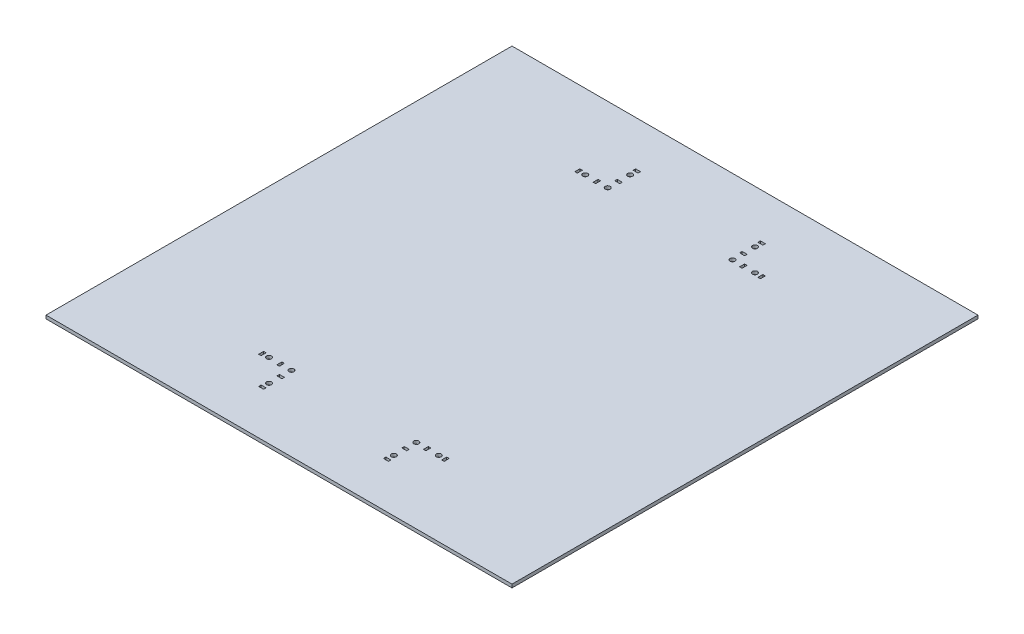
from build123d import *

# Parameters (mm, degrees)
SKETCH_1_W          = 560
SKETCH_1_H          = 560
EXTRUDE_1_DEPTH     = 4
SKETCH_2_R          = 3
SKETCH_2_W          = 3
SKETCH_2_H          = 6
SKETCH_2_W_2        = 6
SKETCH_2_H_2        = 3
CUT_EXTRUDE_1_DEPTH = 4


with BuildPart() as part:
    # 草图1 → 凸台-拉伸1 (new body)
    with BuildSketch(Plane(origin=(0, 0, 0), x_dir=(1, 0, 0), z_dir=(0, 1, 0))):
        Rectangle(SKETCH_1_W, SKETCH_1_H)
    extrude(amount=EXTRUDE_1_DEPTH)

    # 草图2 → 切除-拉伸1 (cut)
    with BuildSketch(Plane(origin=(0, 4, 0), x_dir=(1, 0, 0), z_dir=(0, 1, 0))):
        with Locations(Location((-75, 190, 0), (0, 0, 270))):
            Circle(SKETCH_2_R)
        with Locations(Location((-102, 190, 0), (0, 0, 270))):
            Circle(SKETCH_2_R)
        with Locations(Location((-75, 217, 0), (0, 0, 90))):
            Circle(SKETCH_2_R)
        with Locations(Location((75, 217, 0), (0, 0, 270))):
            Circle(SKETCH_2_R)
        with Locations(Location((102, 190, 0), (0, 0, 90))):
            Circle(SKETCH_2_R)
        with Locations(Location((75, 190, 0), (0, 0, 90))):
            Circle(SKETCH_2_R)
        with Locations(Location((75, -190, 0), (0, 0, 270))):
            Circle(SKETCH_2_R)
        with Locations(Location((102, -190, 0), (0, 0, 270))):
            Circle(SKETCH_2_R)
        with Locations(Location((75, -217, 0), (0, 0, 90))):
            Circle(SKETCH_2_R)
        with Locations(Location((-75, -217, 0), (0, 0, 270))):
            Circle(SKETCH_2_R)
        with Locations(Location((-102, -190, 0), (0, 0, 90))):
            Circle(SKETCH_2_R)
        with Locations(Location((-75, -190, 0), (0, 0, 90))):
            Circle(SKETCH_2_R)
        with Locations((-88, 190)):
            Rectangle(SKETCH_2_W, SKETCH_2_H)
        with Locations((-110, 190)):
            Rectangle(SKETCH_2_W, SKETCH_2_H)
        with Locations((-75, 225)):
            Rectangle(SKETCH_2_W_2, SKETCH_2_H_2)
        with Locations((-75, 203)):
            Rectangle(SKETCH_2_W_2, SKETCH_2_H_2)
        with Locations((75, 203)):
            Rectangle(SKETCH_2_W_2, SKETCH_2_H_2)
        with Locations((75, 225)):
            Rectangle(SKETCH_2_W_2, SKETCH_2_H_2)
        with Locations((110, 190)):
            Rectangle(SKETCH_2_W, SKETCH_2_H)
        with Locations((88, 190)):
            Rectangle(SKETCH_2_W, SKETCH_2_H)
        with Locations((88, -190)):
            Rectangle(SKETCH_2_W, SKETCH_2_H)
        with Locations((110, -190)):
            Rectangle(SKETCH_2_W, SKETCH_2_H)
        with Locations((75, -225)):
            Rectangle(SKETCH_2_W_2, SKETCH_2_H_2)
        with Locations((75, -203)):
            Rectangle(SKETCH_2_W_2, SKETCH_2_H_2)
        with Locations((-75, -203)):
            Rectangle(SKETCH_2_W_2, SKETCH_2_H_2)
        with Locations((-75, -225)):
            Rectangle(SKETCH_2_W_2, SKETCH_2_H_2)
        with Locations((-110, -190)):
            Rectangle(SKETCH_2_W, SKETCH_2_H)
        with Locations((-88, -190)):
            Rectangle(SKETCH_2_W, SKETCH_2_H)
    extrude(amount=-CUT_EXTRUDE_1_DEPTH, mode=Mode.SUBTRACT)


solid = part.part
